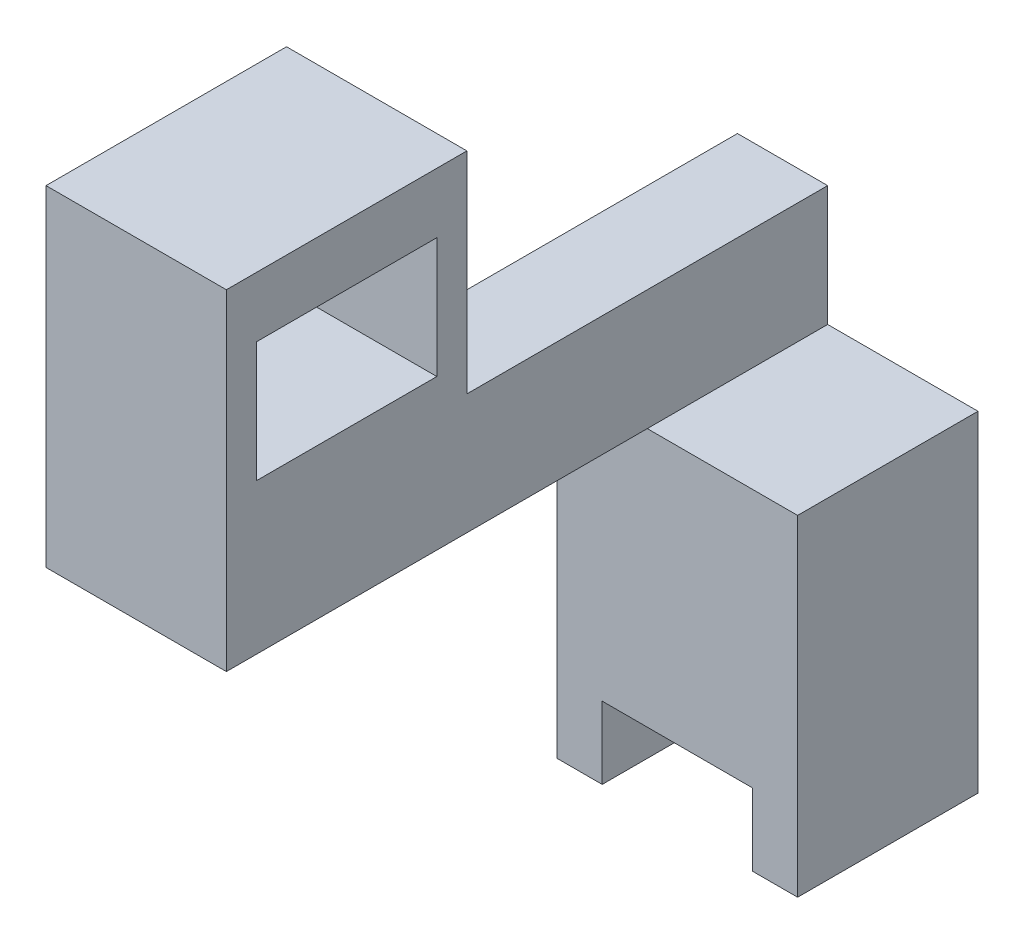
from build123d import *

# Parameters (mm, degrees)
SKETCH_1_W          = 30
SKETCH_1_H          = 55
EXTRUDE_1_DEPTH     = 40
SKETCH_4_W          = 30
SKETCH_4_H          = 20
CUT_EXTRUDE_1_DEPTH = 58.063561053
SKETCH_5_W          = 15
SKETCH_5_H          = 20
EXTRUDE_3_DEPTH     = 60
SKETCH_6_W          = 40
SKETCH_6_H          = 30
EXTRUDE_4_DEPTH     = 55
SKETCH_7_W          = 25
SKETCH_7_H          = 12
CUT_EXTRUDE_2_DEPTH = 116.352719951


with BuildPart() as part:
    # Эскиз1 → Бобышка-Вытянуть1 (new body)
    with BuildSketch(Plane.XY):
        Rectangle(SKETCH_1_W, SKETCH_1_H)
    extrude(amount=EXTRUDE_1_DEPTH)

    # Эскиз4 → Вырез-Вытянуть1 (cut, through all)
    with BuildSketch(Plane(origin=(15, 0, 0), x_dir=(0, 0, -1), z_dir=(1, 0, 0))):
        with Locations((-20, 7.5)):
            Rectangle(SKETCH_4_W, SKETCH_4_H)
    extrude(amount=-CUT_EXTRUDE_1_DEPTH, mode=Mode.SUBTRACT)

    # Эскиз5 → Бобышка-Вытянуть3 (add)
    with BuildSketch(Plane(origin=(0, 0, 0), x_dir=(-1, 0, 0), z_dir=(0, 0, -1))):
        with Locations((-7.5, -17.5)):
            Rectangle(SKETCH_5_W, SKETCH_5_H)
    extrude(amount=EXTRUDE_3_DEPTH)

    # Эскиз6 → Бобышка-Вытянуть4 (add)
    with BuildSketch(Plane.XZ.offset(27.5)):
        with Locations((20, -45)):
            Rectangle(SKETCH_6_W, SKETCH_6_H)
    extrude(amount=EXTRUDE_4_DEPTH)

    # Эскиз7 → Вырез-Вытянуть2 (cut, through all)
    with BuildSketch(Plane.XY.offset(-30)):
        with Locations((20, -76.5)):
            Rectangle(SKETCH_7_W, SKETCH_7_H)
    extrude(amount=-CUT_EXTRUDE_2_DEPTH, mode=Mode.SUBTRACT)


solid = part.part
